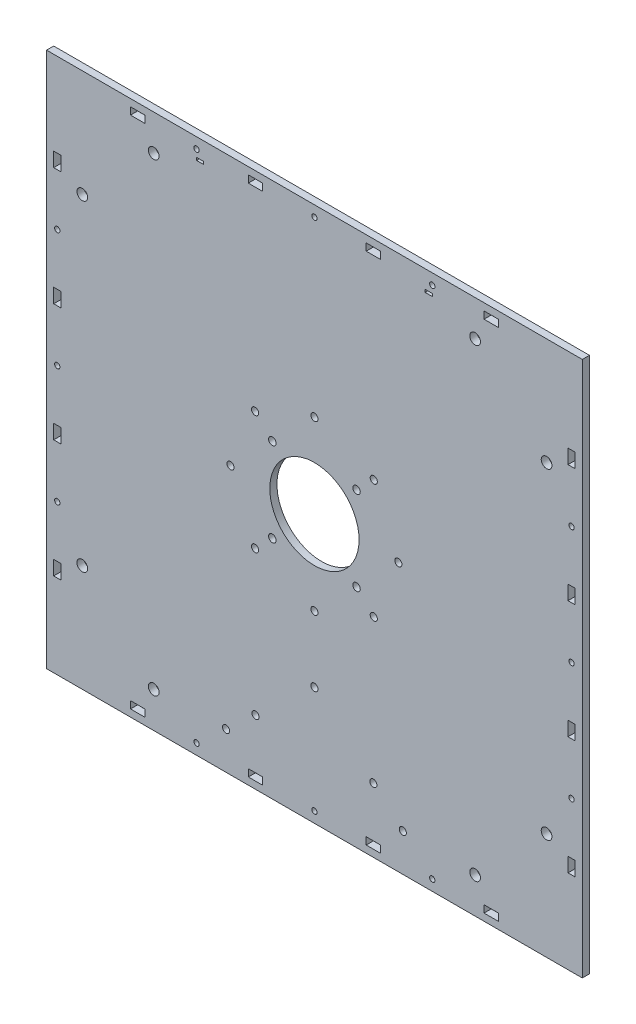
from build123d import *

# Parameters (mm, degrees)
SKETCH_1_R          = 25
SKETCH_1_R_2        = 2.1
SKETCH_1_W          = 4
SKETCH_1_H          = 1.5
EXTRUDE_1_DEPTH     = 4
SKETCH_3_R          = 1.5
SKETCH_3_R_2        = 2
SKETCH_3_W          = 8.03
SKETCH_3_H          = 4.03
SKETCH_3_W_2        = 4.03
SKETCH_3_H_2        = 8.03
CUT_EXTRUDE_2_DEPTH = 4
SKETCH_7_R          = 3
CUT_EXTRUDE_3_DEPTH = 10


with BuildPart() as part:
    # 草图1 → 凸台-拉伸1 (new body)
    with BuildSketch(Plane.XY):
        Polygon((151.457142857, -41.187142857), (151.457142857, 108.812857143), (-148.542857143, 108.812857143), (-148.542857143, -191.187142857), (151.457142857, -191.187142857), align=None)
        with Locations((1.457142857, -41.187142857)):
            Circle(SKETCH_1_R, mode=Mode.SUBTRACT)
        with Locations((25.027142857, -17.617142857)):
            Circle(SKETCH_1_R_2, mode=Mode.SUBTRACT)
        with Locations((25.027142857, -64.757142857)):
            Circle(SKETCH_1_R_2, mode=Mode.SUBTRACT)
        with Locations((-22.112857143, -64.757142857)):
            Circle(SKETCH_1_R_2, mode=Mode.SUBTRACT)
        with Locations((-22.112857143, -17.617142857)):
            Circle(SKETCH_1_R_2, mode=Mode.SUBTRACT)
        with Locations((65.457142857, 98.062857143)):
            Rectangle(SKETCH_1_W, SKETCH_1_H, mode=Mode.SUBTRACT)
        with Locations((-62.542857143, 98.062857143)):
            Rectangle(SKETCH_1_W, SKETCH_1_H, mode=Mode.SUBTRACT)
    extrude(amount=EXTRUDE_1_DEPTH)

    # 草图3 → 切除-拉伸2 (cut)
    with BuildSketch(Plane.XY.offset(4)):
        with Locations((1.457142857, -185.187142857)):
            Circle(SKETCH_3_R)
        with Locations((67.457142857, -185.187142857)):
            Circle(SKETCH_3_R)
        with Locations(Location((-64.542857143, -185.187142857, 0), (0, 0, 180))):
            Circle(SKETCH_3_R)
        with Locations(Location((-142.542857143, 24.812857143, 0), (0, 0, 180))):
            Circle(SKETCH_3_R)
        with Locations((-142.542857143, -41.187142857)):
            Circle(SKETCH_3_R)
        with Locations((-142.542857143, -107.187142857)):
            Circle(SKETCH_3_R)
        with Locations(Location((67.457142857, 102.812857143, 0), (0, 0, 180))):
            Circle(SKETCH_3_R)
        with Locations((1.457142857, 102.812857143)):
            Circle(SKETCH_3_R)
        with Locations((-64.542857143, 102.812857143)):
            Circle(SKETCH_3_R)
        with Locations(Location((145.457142857, -107.187142857, 0), (0, 0, 180))):
            Circle(SKETCH_3_R)
        with Locations((145.457142857, -41.187142857)):
            Circle(SKETCH_3_R)
        with Locations((145.457142857, 24.812857143)):
            Circle(SKETCH_3_R)
        with Locations((50.957142857, -170.187142857)):
            Circle(SKETCH_3_R_2)
        with Locations(Location((-48.042857143, -170.187142857, 0), (0, 0, 180))):
            Circle(SKETCH_3_R_2)
        with Locations((-31.542857143, -155.187142857)):
            Circle(SKETCH_3_R_2)
        with Locations(Location((34.457142857, -155.187142857, 0), (0, 0, 180))):
            Circle(SKETCH_3_R_2)
        with Locations((1.457142857, -88.187142857)):
            Circle(SKETCH_3_R_2)
        with Locations((-31.776875859, -74.421161573)):
            Circle(SKETCH_3_R_2)
        with Locations((-45.542857143, -41.187142857)):
            Circle(SKETCH_3_R_2)
        with Locations((-31.776875859, -7.953124141)):
            Circle(SKETCH_3_R_2)
        with Locations((1.457142857, 5.812857143)):
            Circle(SKETCH_3_R_2)
        with Locations((34.691161573, -7.953124141)):
            Circle(SKETCH_3_R_2)
        with Locations((48.457142857, -41.187142857)):
            Circle(SKETCH_3_R_2)
        with Locations((34.691161573, -74.421161573)):
            Circle(SKETCH_3_R_2)
        with Locations((1.457142857, -125.187142857)):
            Circle(SKETCH_3_R_2)
        with Locations((100.457142857, -185.187142857)):
            Rectangle(SKETCH_3_W, SKETCH_3_H)
        with Locations((34.457142857, -185.187142857)):
            Rectangle(SKETCH_3_W, SKETCH_3_H)
        with Locations((-31.542857143, -185.187142857)):
            Rectangle(SKETCH_3_W, SKETCH_3_H)
        with Locations((-97.542857143, -185.187142857)):
            Rectangle(SKETCH_3_W, SKETCH_3_H)
        with Locations((-142.542857143, 57.812857143)):
            Rectangle(SKETCH_3_W_2, SKETCH_3_H_2)
        with Locations((-142.542857143, -8.187142857)):
            Rectangle(SKETCH_3_W_2, SKETCH_3_H_2)
        with Locations((-142.542857143, -74.187142857)):
            Rectangle(SKETCH_3_W_2, SKETCH_3_H_2)
        with Locations((-142.542857143, -140.187142857)):
            Rectangle(SKETCH_3_W_2, SKETCH_3_H_2)
        with Locations((100.457142857, 102.812857143)):
            Rectangle(SKETCH_3_W, SKETCH_3_H)
        with Locations((34.457142857, 102.812857143)):
            Rectangle(SKETCH_3_W, SKETCH_3_H)
        with Locations((-31.542857143, 102.812857143)):
            Rectangle(SKETCH_3_W, SKETCH_3_H)
        with Locations((-97.542857143, 102.812857143)):
            Rectangle(SKETCH_3_W, SKETCH_3_H)
        with Locations((145.457142857, -140.187142857)):
            Rectangle(SKETCH_3_W_2, SKETCH_3_H_2)
        with Locations((145.457142857, -74.187142857)):
            Rectangle(SKETCH_3_W_2, SKETCH_3_H_2)
        with Locations((145.457142857, -8.187142857)):
            Rectangle(SKETCH_3_W_2, SKETCH_3_H_2)
        with Locations((145.457142857, 57.812857143)):
            Rectangle(SKETCH_3_W_2, SKETCH_3_H_2)
    extrude(amount=-CUT_EXTRUDE_2_DEPTH, mode=Mode.SUBTRACT)

    # 草图7 → 切除-拉伸3 (cut)
    with BuildSketch(Plane.XY.offset(4)):
        with Locations((-88.542857143, -171.187142857)):
            Circle(SKETCH_7_R)
        with Locations((91.457142857, -171.187142857)):
            Circle(SKETCH_7_R)
        with Locations((-128.542857143, 48.812857143)):
            Circle(SKETCH_7_R)
        with Locations((-128.542857143, -131.187142857)):
            Circle(SKETCH_7_R)
        with Locations((91.457142857, 88.812857143)):
            Circle(SKETCH_7_R)
        with Locations((-88.542857143, 88.812857143)):
            Circle(SKETCH_7_R)
        with Locations((131.457142857, -131.187142857)):
            Circle(SKETCH_7_R)
        with Locations((131.457142857, 48.812857143)):
            Circle(SKETCH_7_R)
    extrude(amount=-CUT_EXTRUDE_3_DEPTH, mode=Mode.SUBTRACT)


solid = part.part
